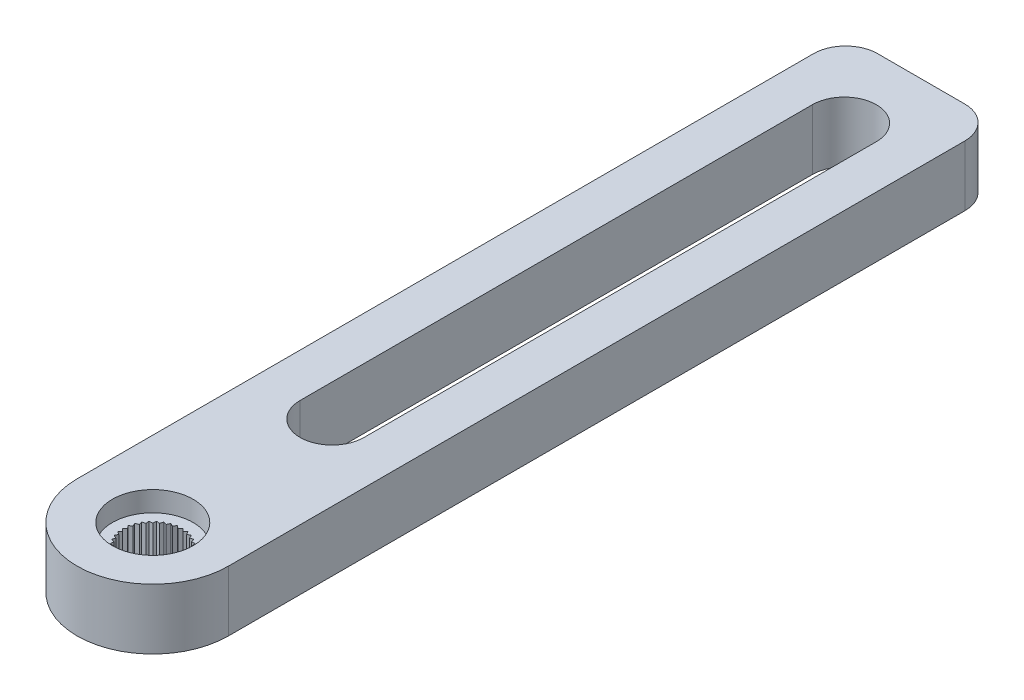
from build123d import *

# Parameters (mm, degrees)
SALIENTE_EXTRUIR1_DEPTH = 4
CROQUIS1_3_R            = 4
SALIENTE_EXTRUIR2_DEPTH = 6
SALIENTE_EXTRUIR3_DEPTH = 4
MATRIZC1_COUNT          = 36
FILLET1_R               = 3.175


with BuildPart() as part:
    # Croquis1 → Saliente-Extruir1 (new body)
    with BuildSketch(Plane(origin=(0, 0, 0), x_dir=(1, 0, 0), z_dir=(0, 1, 0))):
        with BuildLine():
            Line((-7.5, 76.2), (-7.5, 0))
            ThreePointArc((-7.5, 0), (0, -7.5), (7.5, 0))
            Line((7.5, 0), (7.5, 76.2))
            Line((7.5, 76.2), (-7.5, 76.2))
        make_face()
        with BuildLine():
            ThreePointArc((-3.175, 68.58), (0, 71.755), (3.175, 68.58))
            Line((3.175, 68.58), (3.175, 17.78))
            ThreePointArc((3.175, 17.78), (0, 14.605), (-3.175, 17.78))
            Line((-3.175, 17.78), (-3.175, 68.58))
        make_face(mode=Mode.SUBTRACT)
        with BuildLine():
            ThreePointArc((-2.988584094, 0.261467228), (-2.974334584, 0.391578577), (-2.954423259, 0.520944533))
            ThreePointArc((-2.954423259, 0.520944533), (2.974334584, -0.391578577), (-2.988584094, 0.261467228))
        make_face(mode=Mode.SUBTRACT)
    extrude(amount=SALIENTE_EXTRUIR1_DEPTH)

    # Croquis1<3> → Saliente-Extruir2 (add)
    with BuildSketch(Plane(origin=(0, 0, 0), x_dir=(1, 0, 0), z_dir=(0, 1, 0))):
        with BuildLine():
            Line((-7.5, 76.2), (-7.5, 0))
            ThreePointArc((-7.5, 0), (0, -7.5), (7.5, 0))
            Line((7.5, 0), (7.5, 76.2))
            Line((7.5, 76.2), (-7.5, 76.2))
        make_face()
        with BuildLine():
            ThreePointArc((-3.175, 68.58), (0, 71.755), (3.175, 68.58))
            Line((3.175, 68.58), (3.175, 17.78))
            ThreePointArc((3.175, 17.78), (0, 14.605), (-3.175, 17.78))
            Line((-3.175, 17.78), (-3.175, 68.58))
        make_face(mode=Mode.SUBTRACT)
        Circle(CROQUIS1_3_R, mode=Mode.SUBTRACT)
    extrude(amount=SALIENTE_EXTRUIR2_DEPTH)

    # Croquis1<4> → Saliente-Extruir3 (add)
    with BuildSketch(Plane(origin=(0, 0, 0), x_dir=(1, 0, 0), z_dir=(0, 1, 0))):
        with BuildLine():
            Line((-3, 0), (-2.73953542, 0.239678293))
            Line((-2.73953542, 0.239678293), (-2.954423259, 0.520944533))
            ThreePointArc((-2.954423259, 0.520944533), (-2.988584094, 0.261467228), (-3, 0))
        make_face()
    saliente_extruir3 = extrude(amount=SALIENTE_EXTRUIR3_DEPTH)

    # MatrizC1: Saliente-Extruir3 ×36 about axis
    matrizc1_axis = Axis((0, 6, 0), (0, -1, 0))
    for i in range(1, MATRIZC1_COUNT):
        add(saliente_extruir3.rotate(matrizc1_axis, i * 360 / MATRIZC1_COUNT))

    # Fillet1
    fillet1_edges = [part.edges().sort_by_distance(p)[0] for p in [
        (-7.5, 3, -76.2),
        (7.5, 3, -76.2),
    ]]
    fillet(fillet1_edges, radius=FILLET1_R)


solid = part.part
